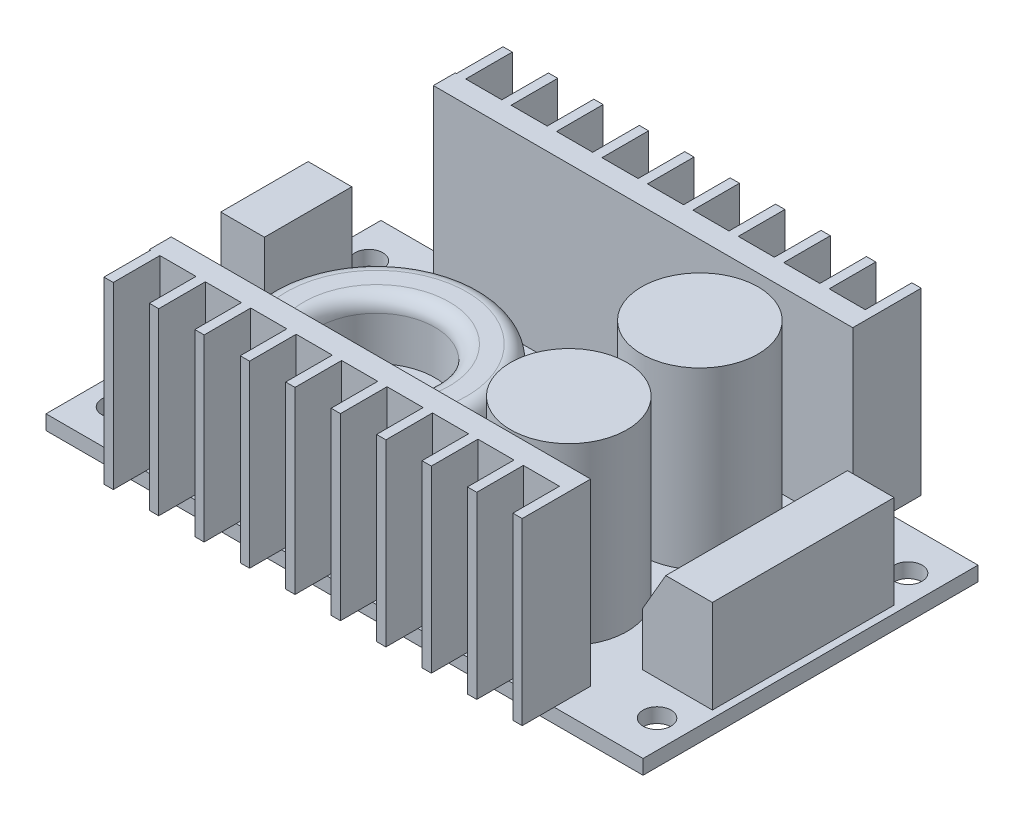
from build123d import *

# Parameters (mm, degrees)
SKETCH1_W               = 65.0875
SKETCH1_H               = 36.5125
BOSS_EXTRUDE1_DEPTH     = 1.5875
SKETCH2_W               = 45.72
SKETCH2_H               = 2.38125
BOSS_EXTRUDE2_DEPTH     = 19.558
SKETCH3_W               = 1.016
SKETCH3_H               = 19.558
BOSS_EXTRUDE3_DEPTH     = 5.08
LPATTERN1_COUNT         = 10
LPATTERN1_PITCH         = 4.953
SKETCH4_R               = 6.35
BOSS_EXTRUDE4_DEPTH     = 19.05
SKETCH5_R               = 1.524
CUT_EXTRUDE1_DEPTH      = 19.05
MIRROR1_COPY_1_SKETCH_W = 1.016
MIRROR1_COPY_1_SKETCH_H = 19.558
MIRROR1_COPY_1_DEPTH    = 5.08
MIRROR1_COPY_2_SKETCH_W = 1.016
MIRROR1_COPY_2_SKETCH_H = 19.558
MIRROR1_COPY_2_DEPTH    = 5.08
MIRROR1_COPY_3_SKETCH_W = 1.016
MIRROR1_COPY_3_SKETCH_H = 19.558
MIRROR1_COPY_3_DEPTH    = 5.08
MIRROR1_COPY_4_SKETCH_W = 1.016
MIRROR1_COPY_4_SKETCH_H = 19.558
MIRROR1_COPY_4_DEPTH    = 5.08
MIRROR1_COPY_5_SKETCH_W = 1.016
MIRROR1_COPY_5_SKETCH_H = 19.558
MIRROR1_COPY_5_DEPTH    = 5.08
MIRROR1_COPY_6_SKETCH_W = 1.016
MIRROR1_COPY_6_SKETCH_H = 19.558
MIRROR1_COPY_6_DEPTH    = 5.08
MIRROR1_COPY_7_SKETCH_W = 1.016
MIRROR1_COPY_7_SKETCH_H = 19.558
MIRROR1_COPY_7_DEPTH    = 5.08
MIRROR1_COPY_8_SKETCH_W = 1.016
MIRROR1_COPY_8_SKETCH_H = 19.558
MIRROR1_COPY_8_DEPTH    = 5.08
MIRROR1_COPY_9_SKETCH_W = 1.016
MIRROR1_COPY_9_SKETCH_H = 19.558
MIRROR1_COPY_9_DEPTH    = 5.08
SKETCH6_R               = 11.43
SKETCH6_R_2             = 6.35
BOSS_EXTRUDE5_DEPTH     = 6.35
FILLET1_R               = 1.5875
SKETCH7_W               = 7.62
SKETCH7_H               = 19.812
BOSS_EXTRUDE6_DEPTH     = 10.16
CHAMFER1_SIZE           = 2.54
CHAMFER1_SIZE2          = 4.399409051
SKETCH8_W               = 4.7625
SKETCH8_H               = 9.525
BOSS_EXTRUDE7_DEPTH     = 10.31875


with BuildPart() as part:
    # Sketch1 → Boss-Extrude1 (new body)
    with BuildSketch(Plane(origin=(0, 0, 0), x_dir=(1, 0, 0), z_dir=(0, 1, 0))):
        Rectangle(SKETCH1_W, SKETCH1_H)
    extrude(amount=BOSS_EXTRUDE1_DEPTH)

    # Sketch2 → Boss-Extrude2 (add)
    with BuildSketch(Plane(origin=(0, 1.5875, 0), x_dir=(1, 0, 0), z_dir=(0, 1, 0))):
        with Locations((0, 15.478125)):
            Rectangle(SKETCH2_W, SKETCH2_H)
    boss_extrude2 = extrude(amount=BOSS_EXTRUDE2_DEPTH)

    # Sketch3 → Boss-Extrude3 (add)
    with BuildSketch(Plane(origin=(0, 0, -16.66875), x_dir=(-1, 0, 0), z_dir=(0, 0, -1))):
        with Locations((-22.352, 11.3665)):
            Rectangle(SKETCH3_W, SKETCH3_H)
    boss_extrude3 = extrude(amount=BOSS_EXTRUDE3_DEPTH)

    # LPattern1: Boss-Extrude3 ×10
    with Locations(*[(-i * LPATTERN1_PITCH, 0, 0) for i in range(1, LPATTERN1_COUNT)]):
        add(boss_extrude3)

    # Sketch4 → Boss-Extrude4 (add)
    with BuildSketch(Plane(origin=(0, 1.5875, 0), x_dir=(1, 0, 0), z_dir=(0, 1, 0))):
        with Locations(Location((13.335, 7.14375, 0), (0, 0, 90))):
            Circle(SKETCH4_R)
    boss_extrude4 = extrude(amount=BOSS_EXTRUDE4_DEPTH)

    # Sketch5 → Cut-Extrude1 (cut)
    with BuildSketch(Plane(origin=(0, 1.5875, 0), x_dir=(1, 0, 0), z_dir=(0, 1, 0))):
        with Locations(Location((29.49575, 13.68425, 0), (0, 0, 270))):
            Circle(SKETCH5_R)
        with Locations(Location((-29.384474521, 13.78665039, 0), (0, 0, 270))):
            Circle(SKETCH5_R)
    cut_extrude1 = extrude(amount=-CUT_EXTRUDE1_DEPTH, mode=Mode.SUBTRACT)

    # Mirror1: Boss-Extrude2, Boss-Extrude3, Boss-Extrude4, Cut-Extrude1 across plane
    add(boss_extrude2.mirror(Plane.XY))
    add(boss_extrude3.mirror(Plane.XY))
    add(boss_extrude4.mirror(Plane.XY))
    add(cut_extrude1.mirror(Plane.XY), mode=Mode.SUBTRACT)

    # Mirror1 copy 1 sketch → Mirror1 copy 1 (add)
    with BuildSketch(Plane(origin=(-4.953, 0, 16.66875), x_dir=(-1, 0, 0), z_dir=(0, 0, 1))):
        with Locations((-22.352, -11.3665)):
            Rectangle(MIRROR1_COPY_1_SKETCH_W, MIRROR1_COPY_1_SKETCH_H)
    extrude(amount=MIRROR1_COPY_1_DEPTH)

    # Mirror1 copy 2 sketch → Mirror1 copy 2 (add)
    with BuildSketch(Plane(origin=(-9.906, 0, 16.66875), x_dir=(-1, 0, 0), z_dir=(0, 0, 1))):
        with Locations((-22.352, -11.3665)):
            Rectangle(MIRROR1_COPY_2_SKETCH_W, MIRROR1_COPY_2_SKETCH_H)
    extrude(amount=MIRROR1_COPY_2_DEPTH)

    # Mirror1 copy 3 sketch → Mirror1 copy 3 (add)
    with BuildSketch(Plane(origin=(-14.859, 0, 16.66875), x_dir=(-1, 0, 0), z_dir=(0, 0, 1))):
        with Locations((-22.352, -11.3665)):
            Rectangle(MIRROR1_COPY_3_SKETCH_W, MIRROR1_COPY_3_SKETCH_H)
    extrude(amount=MIRROR1_COPY_3_DEPTH)

    # Mirror1 copy 4 sketch → Mirror1 copy 4 (add)
    with BuildSketch(Plane(origin=(-19.812, 0, 16.66875), x_dir=(-1, 0, 0), z_dir=(0, 0, 1))):
        with Locations((-22.352, -11.3665)):
            Rectangle(MIRROR1_COPY_4_SKETCH_W, MIRROR1_COPY_4_SKETCH_H)
    extrude(amount=MIRROR1_COPY_4_DEPTH)

    # Mirror1 copy 5 sketch → Mirror1 copy 5 (add)
    with BuildSketch(Plane(origin=(-24.765, 0, 16.66875), x_dir=(-1, 0, 0), z_dir=(0, 0, 1))):
        with Locations((-22.352, -11.3665)):
            Rectangle(MIRROR1_COPY_5_SKETCH_W, MIRROR1_COPY_5_SKETCH_H)
    extrude(amount=MIRROR1_COPY_5_DEPTH)

    # Mirror1 copy 6 sketch → Mirror1 copy 6 (add)
    with BuildSketch(Plane(origin=(-29.718, 0, 16.66875), x_dir=(-1, 0, 0), z_dir=(0, 0, 1))):
        with Locations((-22.352, -11.3665)):
            Rectangle(MIRROR1_COPY_6_SKETCH_W, MIRROR1_COPY_6_SKETCH_H)
    extrude(amount=MIRROR1_COPY_6_DEPTH)

    # Mirror1 copy 7 sketch → Mirror1 copy 7 (add)
    with BuildSketch(Plane(origin=(-34.671, 0, 16.66875), x_dir=(-1, 0, 0), z_dir=(0, 0, 1))):
        with Locations((-22.352, -11.3665)):
            Rectangle(MIRROR1_COPY_7_SKETCH_W, MIRROR1_COPY_7_SKETCH_H)
    extrude(amount=MIRROR1_COPY_7_DEPTH)

    # Mirror1 copy 8 sketch → Mirror1 copy 8 (add)
    with BuildSketch(Plane(origin=(-39.624, 0, 16.66875), x_dir=(-1, 0, 0), z_dir=(0, 0, 1))):
        with Locations((-22.352, -11.3665)):
            Rectangle(MIRROR1_COPY_8_SKETCH_W, MIRROR1_COPY_8_SKETCH_H)
    extrude(amount=MIRROR1_COPY_8_DEPTH)

    # Mirror1 copy 9 sketch → Mirror1 copy 9 (add)
    with BuildSketch(Plane(origin=(-44.577, 0, 16.66875), x_dir=(-1, 0, 0), z_dir=(0, 0, 1))):
        with Locations((-22.352, -11.3665)):
            Rectangle(MIRROR1_COPY_9_SKETCH_W, MIRROR1_COPY_9_SKETCH_H)
    extrude(amount=MIRROR1_COPY_9_DEPTH)

    # Sketch6 → Boss-Extrude5 (add)
    with BuildSketch(Plane(origin=(0, 1.5875, 0), x_dir=(1, 0, 0), z_dir=(0, 1, 0))):
        with Locations(Location((-14.76375, 0, 0), (0, 0, 270))):
            Circle(SKETCH6_R)
        with Locations(Location((-14.76375, 0, 0), (0, 0, 270))):
            Circle(SKETCH6_R_2, mode=Mode.SUBTRACT)
    extrude(amount=BOSS_EXTRUDE5_DEPTH)

    # Fillet1
    fillet1_edges = [part.edges().sort_by_distance(p)[0] for p in [
        (-14.76375, 7.9375, -11.43),
        (-14.76375, 7.9375, -6.35),
    ]]
    fillet(fillet1_edges, radius=FILLET1_R)

    # Sketch7 → Boss-Extrude6 (add)
    with BuildSketch(Plane(origin=(0, 1.5875, 0), x_dir=(1, 0, 0), z_dir=(0, 1, 0))):
        with Locations((27.94, 0)):
            Rectangle(SKETCH7_W, SKETCH7_H)
    extrude(amount=BOSS_EXTRUDE6_DEPTH)

    # Chamfer1
    chamfer1_edges = [part.edges().sort_by_distance(p)[0] for p in [
        (24.13, 11.7475, 0),
    ]]
    chamfer1_side = [part.faces().sort_by_distance(p)[0] for p in [
        (27.94, 11.7475, 0),
    ]]
    chamfer(chamfer1_edges, length=CHAMFER1_SIZE, length2=CHAMFER1_SIZE2, reference=chamfer1_side[0])

    # Sketch8 → Boss-Extrude7 (add)
    with BuildSketch(Plane(origin=(0, 1.5875, 0), x_dir=(1, 0, 0), z_dir=(0, 1, 0))):
        with Locations((-29.36875, 4.7625)):
            Rectangle(SKETCH8_W, SKETCH8_H)
    extrude(amount=BOSS_EXTRUDE7_DEPTH)


solid = part.part
